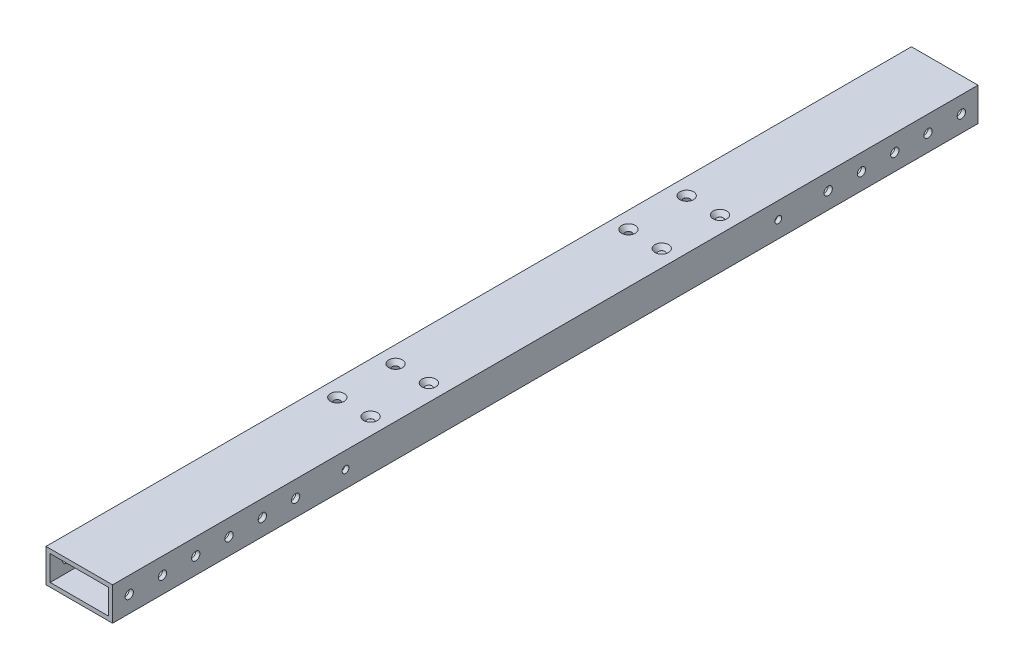
from build123d import *

# Parameters (mm, degrees)
BOSS_EXTRUDE1_DEPTH              = 330.2
BOSS_EXTRUDE1_DEPTH_BACK         = 330.2
SKETCH3_W                        = 50.8
SKETCH3_H                        = 25.4
SKETCH3_W_2                      = 44.45
SKETCH3_H_2                      = 19.05
F_1_4_0_25_DIAMETER_HOLE3_D      = 6.35
F_1_4_0_25_DIAMETER_HOLE4_D      = 6.35
F_1_4_0_25_DIAMETER_HOLE5_D      = 6.35
F_1_4_0_25_DIAMETER_HOLE6_D      = 6.35
F_1_4_0_25_DIAMETER_HOLE7_D      = 6.35
F_1_4_0_25_DIAMETER_HOLE8_D      = 6.35
F_13_64_0_20313_DIAMETER_HOLE1_D = 5.159502
F_1_2_0_5_DIAMETER_HOLE1_D       = 12.7
F_1_2_0_5_DIAMETER_HOLE1_DEPTH   = 6.35
F_1_2_0_5_DIAMETER_HOLE1_TIP     = 3.815464931
F_10_CLEARANCE_HOLE1_AT_2_COUNT  = 2
F_10_CLEARANCE_HOLE1_AT_2_PITCH  = 25.4
F_10_CLEARANCE_HOLE1_AT_3_COUNT  = 2
F_10_CLEARANCE_HOLE1_AT_3_PITCH  = 51.195336702
F_10_CLEARANCE_HOLE1_AT_4_COUNT  = 2
F_10_CLEARANCE_HOLE1_AT_4_PITCH  = 44.45
F_10_CLEARANCE_HOLE1_AT_5_COUNT  = 2
F_10_CLEARANCE_HOLE1_AT_5_PITCH  = 223.596969524
F_10_CLEARANCE_HOLE1_AT_6_COUNT  = 2
F_10_CLEARANCE_HOLE1_AT_6_PITCH  = 222.1496
F_10_CLEARANCE_HOLE1_AT_7_COUNT  = 2
F_10_CLEARANCE_HOLE1_AT_7_PITCH  = 266.5996
F_10_CLEARANCE_HOLE1_AT_8_COUNT  = 2
F_10_CLEARANCE_HOLE1_AT_8_PITCH  = 267.806845917


with BuildPart() as part:
    # Sketch3 → Boss-Extrude1 (new, two sides: drawn at the far end of the back side and taken through both)
    with BuildSketch(Plane.XY.offset(-BOSS_EXTRUDE1_DEPTH_BACK)):
        Rectangle(SKETCH3_W, SKETCH3_H)
        Rectangle(SKETCH3_W_2, SKETCH3_H_2, mode=Mode.SUBTRACT)
    extrude(amount=BOSS_EXTRUDE1_DEPTH + BOSS_EXTRUDE1_DEPTH_BACK)

    # 1/4 (0.25) Diameter Hole3 (through all)
    with Locations(Plane.ZY.offset(25.4)):
        with Locations((-317.5, 0)):
            Hole(F_1_4_0_25_DIAMETER_HOLE3_D / 2)

    # 1/4 (0.25) Diameter Hole4 (through all)
    with Locations(Plane.ZY.offset(25.4)):
        with Locations((292.1, 0), (317.5, 0)):
            Hole(F_1_4_0_25_DIAMETER_HOLE4_D / 2)

    # 1/4 (0.25) Diameter Hole5 (through all)
    with Locations(Plane(origin=(25.4, 0, 0), x_dir=(0, 0, -1), z_dir=(1, 0, 0))):
        with Locations((292.1, 0), (266.7, 0)):
            Hole(F_1_4_0_25_DIAMETER_HOLE5_D / 2)

    # 1/4 (0.25) Diameter Hole6 (through all)
    with Locations(Plane(origin=(25.4, 0, 0), x_dir=(0, 0, -1), z_dir=(1, 0, 0))):
        with Locations((215.9, 0), (241.3, 0)):
            Hole(F_1_4_0_25_DIAMETER_HOLE6_D / 2)

    # 1/4 (0.25) Diameter Hole7 (through all)
    with Locations(Plane(origin=(25.4, 0, 0), x_dir=(0, 0, -1), z_dir=(1, 0, 0))):
        with Locations((-190.5, 0), (-215.9, 0)):
            Hole(F_1_4_0_25_DIAMETER_HOLE7_D / 2)

    # 1/4 (0.25) Diameter Hole8 (through all)
    with Locations(Plane(origin=(25.4, 0, 0), x_dir=(0, 0, -1), z_dir=(1, 0, 0))):
        with Locations((-266.7, 0), (-241.3, 0)):
            Hole(F_1_4_0_25_DIAMETER_HOLE8_D / 2)

    # 13/64 (0.20313) Diameter Hole1 (through all)
    with Locations(Plane(origin=(25.4, 0, 0), x_dir=(0, 0, -1), z_dir=(1, 0, 0))):
        with Locations((-152.4, 0), (177.8, 0)):
            Hole(F_13_64_0_20313_DIAMETER_HOLE1_D / 2)

    # 1/2 (0.5) Diameter Hole1
    with Locations(Plane.ZY.offset(25.4)):
        with Locations((-146.050000508, 4.9e-08), (120.65, 1.7e-08)):
            Hole(F_1_2_0_5_DIAMETER_HOLE1_D / 2, depth=F_1_2_0_5_DIAMETER_HOLE1_DEPTH)
            with Locations((0, 0, -(F_1_2_0_5_DIAMETER_HOLE1_DEPTH + F_1_2_0_5_DIAMETER_HOLE1_TIP / 2))):  # 118° drill point
                Cone(0, F_1_2_0_5_DIAMETER_HOLE1_D / 2, F_1_2_0_5_DIAMETER_HOLE1_TIP, mode=Mode.SUBTRACT)

    # Sketch40 → #10 Clearance Hole1 (revolve, cut)
    with BuildSketch(Plane(origin=(-12.7, -12.7, -145.9998), x_dir=(0, 0, -1), z_dir=(1, 0, 0))):
        Polygon((0, 0), (0, 25.4), (5.2197, 25.4), (2.4892, 22.258919064), (2.4892, 0), align=None)
    f_10_clearance_hole1 = revolve(axis=Axis((-12.7, -19.05, -145.9998), (0, 1, 0)), mode=Mode.SUBTRACT)

    # #10 Clearance Hole1 at 2: #10 Clearance Hole1 ×2
    with Locations(*[(i * F_10_CLEARANCE_HOLE1_AT_2_PITCH, 0, 0) for i in range(1, F_10_CLEARANCE_HOLE1_AT_2_COUNT)]):
        add(f_10_clearance_hole1, mode=Mode.SUBTRACT)

    # #10 Clearance Hole1 at 3: #10 Clearance Hole1 ×2
    with Locations(*[Vector(0.4961389383568339, 0, 0.8682431421244592) * (i * F_10_CLEARANCE_HOLE1_AT_3_PITCH) for i in range(1, F_10_CLEARANCE_HOLE1_AT_3_COUNT)]):
        add(f_10_clearance_hole1, mode=Mode.SUBTRACT)

    # #10 Clearance Hole1 at 4: #10 Clearance Hole1 ×2
    with Locations(*[(0, 0, i * F_10_CLEARANCE_HOLE1_AT_4_PITCH) for i in range(1, F_10_CLEARANCE_HOLE1_AT_4_COUNT)]):
        add(f_10_clearance_hole1, mode=Mode.SUBTRACT)

    # #10 Clearance Hole1 at 5: #10 Clearance Hole1 ×2
    with Locations(*[Vector(0.11359724621542587, 0, 0.9935268821991039) * (i * F_10_CLEARANCE_HOLE1_AT_5_PITCH) for i in range(1, F_10_CLEARANCE_HOLE1_AT_5_COUNT)]):
        add(f_10_clearance_hole1, mode=Mode.SUBTRACT)

    # #10 Clearance Hole1 at 6: #10 Clearance Hole1 ×2
    with Locations(*[(0, 0, i * F_10_CLEARANCE_HOLE1_AT_6_PITCH) for i in range(1, F_10_CLEARANCE_HOLE1_AT_6_COUNT)]):
        add(f_10_clearance_hole1, mode=Mode.SUBTRACT)

    # #10 Clearance Hole1 at 7: #10 Clearance Hole1 ×2
    with Locations(*[(0, 0, i * F_10_CLEARANCE_HOLE1_AT_7_PITCH) for i in range(1, F_10_CLEARANCE_HOLE1_AT_7_COUNT)]):
        add(f_10_clearance_hole1, mode=Mode.SUBTRACT)

    # #10 Clearance Hole1 at 8: #10 Clearance Hole1 ×2
    with Locations(*[Vector(0.09484447611114116, 0, 0.9954921021038807) * (i * F_10_CLEARANCE_HOLE1_AT_8_PITCH) for i in range(1, F_10_CLEARANCE_HOLE1_AT_8_COUNT)]):
        add(f_10_clearance_hole1, mode=Mode.SUBTRACT)


solid = part.part
